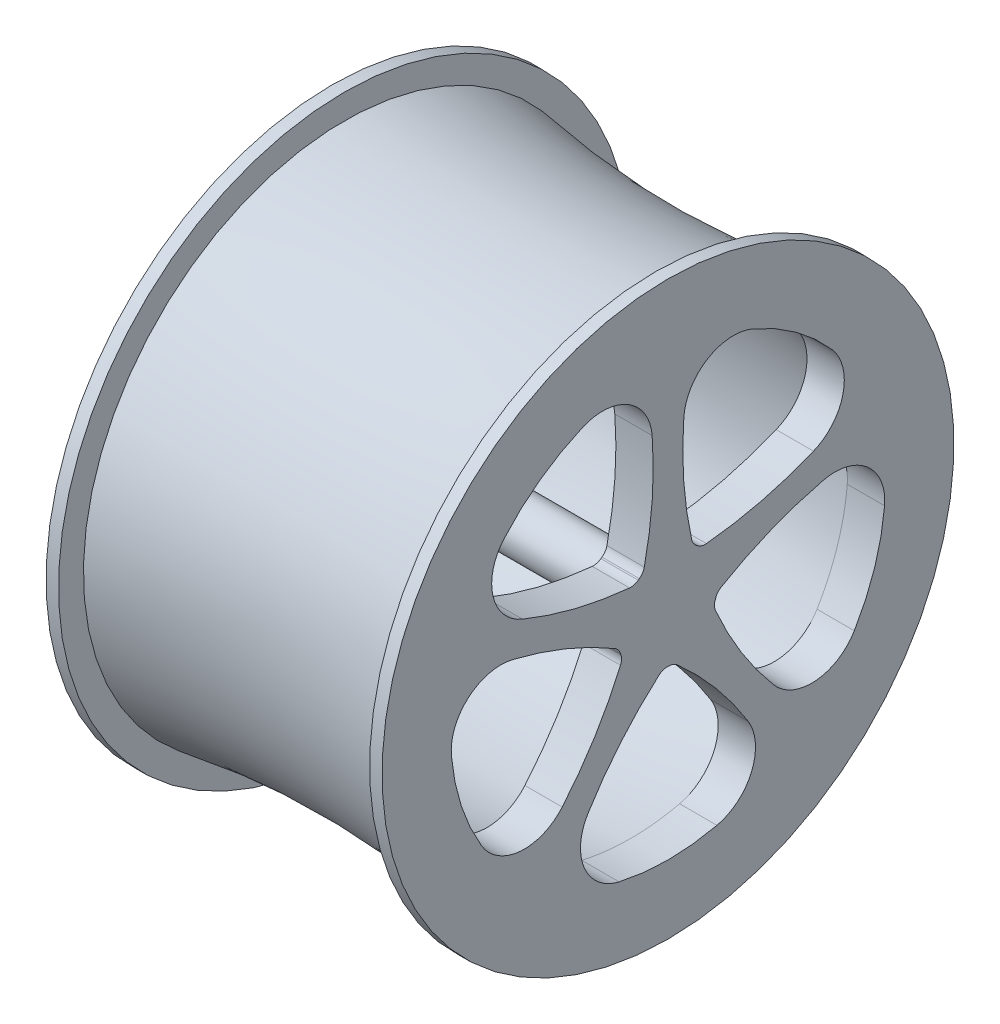
from build123d import *

# Parameters (mm, degrees)
SKETCH1_W          = 8.5
SKETCH1_H          = 1
CUT_EXTRUDE1_DEPTH = 10
CIRPATTERN1_COUNT  = 5


with BuildPart() as part:
    # Sketch1 → Revolve1 (revolve)
    with BuildSketch(Plane.XY, mode=Mode.PRIVATE) as revolve1_sk:
        with BuildLine():
            Line((0, 2), (0, 1))
            Line((0, 1), (1.5, 1))
            Line((1.5, 1), (1.5, 0))
            Line((1.5, 0), (18.5, 0))
            Line((18.5, 0), (18.5, 20.98))
            Line((18.5, 20.98), (18.5, 22.98))
            Line((18.5, 22.98), (17.5, 22.98))
            Line((17.5, 22.98), (17.5, 20.98))
            ThreePointArc((17.5, 20.98), (8.773857065, 20.063613383), (0, 20.132657923))
            Line((0, 20.132657923), (0, 18.145472326))
            ThreePointArc((0, 18.145472326), (7.76473284, 18.155889449), (15.5, 17.48))
            Line((15.5, 17.48), (15.5, 2))
            Line((15.5, 2), (0, 2))
        make_face()
        with BuildLine():
            ThreePointArc((-7.5, 17.48), (-3.757139508, 17.893199785), (0, 18.145472326))
            Line((0, 18.145472326), (0, 20.132657923))
            ThreePointArc((0, 20.132657923), (-3.760250975, 20.465595459), (-7.5, 20.98))
            Line((-7.5, 20.98), (-7.5, 17.48))
        make_face()
        Polygon((-7.5, 22.98), (-7.5, 20.98), (-7.5, 17.48), (-8.5, 17.48), (-8.5, 20.98), (-8.5, 22.98), align=None)
        with Locations((-4.25, 1.5)):
            Rectangle(SKETCH1_W, SKETCH1_H)
    revolve(revolve1_sk.sketch.rotate(Axis((1.5, 0, 0), (1, 0, 0)), 180), axis=Axis((1.5, 0, 0), (1, 0, 0)))

    # Sketch2 → Cut-Extrude1 (cut)
    with BuildSketch(Plane(origin=(18.5, 0, 0), x_dir=(0, 0, -1), z_dir=(1, 0, 0))):
        with BuildLine():
            ThreePointArc((2.395478081, 3.203386453), (2.351141009, 3.236067978), (2.306358123, 3.268135892))
            ThreePointArc((2.306358123, 3.268135892), (2.050929666, 3.530421213), (1.907022642, 3.867063538))
            ThreePointArc((1.907022642, 3.867063538), (1.261654903, 8.263860551), (1.272877627, 12.707754963))
            ThreePointArc((1.272877627, 12.707754963), (3.182475716, 15.818905125), (6.82330992, 16.083756945))
            ThreePointArc((6.82330992, 16.083756945), (10.269346776, 14.134543237), (13.188043125, 11.459507592))
            ThreePointArc((13.188043125, 11.459507592), (14.061233719, 7.915024784), (11.692452347, 5.137490805))
            ThreePointArc((11.692452347, 5.137490805), (7.469525621, 3.753578466), (3.088493572, 3.008674662))
            ThreePointArc((3.088493572, 3.008674662), (2.723857979, 3.041510175), (2.395478081, 3.203386453))
        make_face()
    cut_extrude1 = extrude(amount=-CUT_EXTRUDE1_DEPTH, mode=Mode.SUBTRACT)

    # CirPattern1: Cut-Extrude1 ×5 about axis
    cirpattern1_axis = Axis((0, 0, 0), (1, 0, 0))
    for i in range(1, CIRPATTERN1_COUNT):
        add(cut_extrude1.rotate(cirpattern1_axis, i * 360 / CIRPATTERN1_COUNT), mode=Mode.SUBTRACT)


solid = part.part
